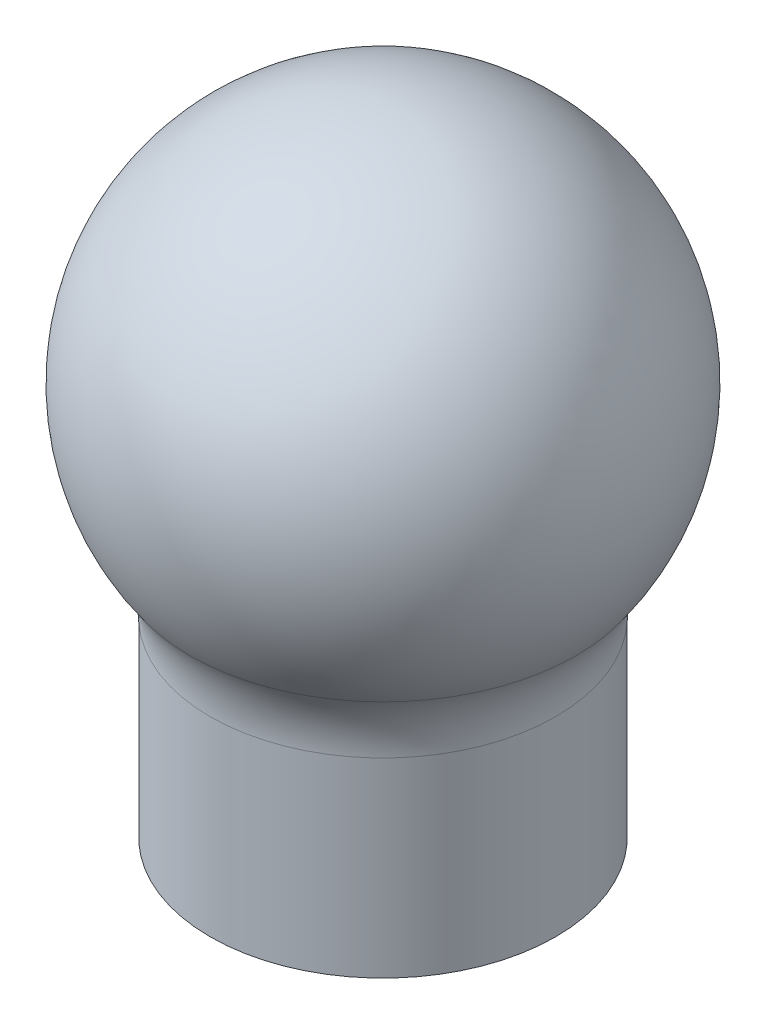
from build123d import *

# Parameters (mm, degrees)
SKETCH1_R           = 29
BOSS_EXTRUDE1_DEPTH = 32


with BuildPart() as part:
    # Sketch1 → Boss-Extrude1 (new body)
    with BuildSketch(Plane(origin=(0, 0, 0), x_dir=(1, 0, 0), z_dir=(0, 1, 0))):
        with Locations(Location((0, 0, 0), (0, 0, 270))):
            Circle(SKETCH1_R)
    extrude(amount=BOSS_EXTRUDE1_DEPTH)

    # Sketch2 → Revolve1 (revolve)
    with BuildSketch(Plane.XY):
        with BuildLine():
            Line((-29, 32), (0, 32))
            Line((0, 32), (0, 106))
            ThreePointArc((0, 106), (-35.617387288, 84.204442392), (-32.419733751, 42.570086139))
            ThreePointArc((-32.419733751, 42.570086139), (-29.876205733, 37.554756969), (-29, 32))
        make_face()
    revolve(axis=Axis((0, 32, 0), (0, 1, 0)))


solid = part.part
